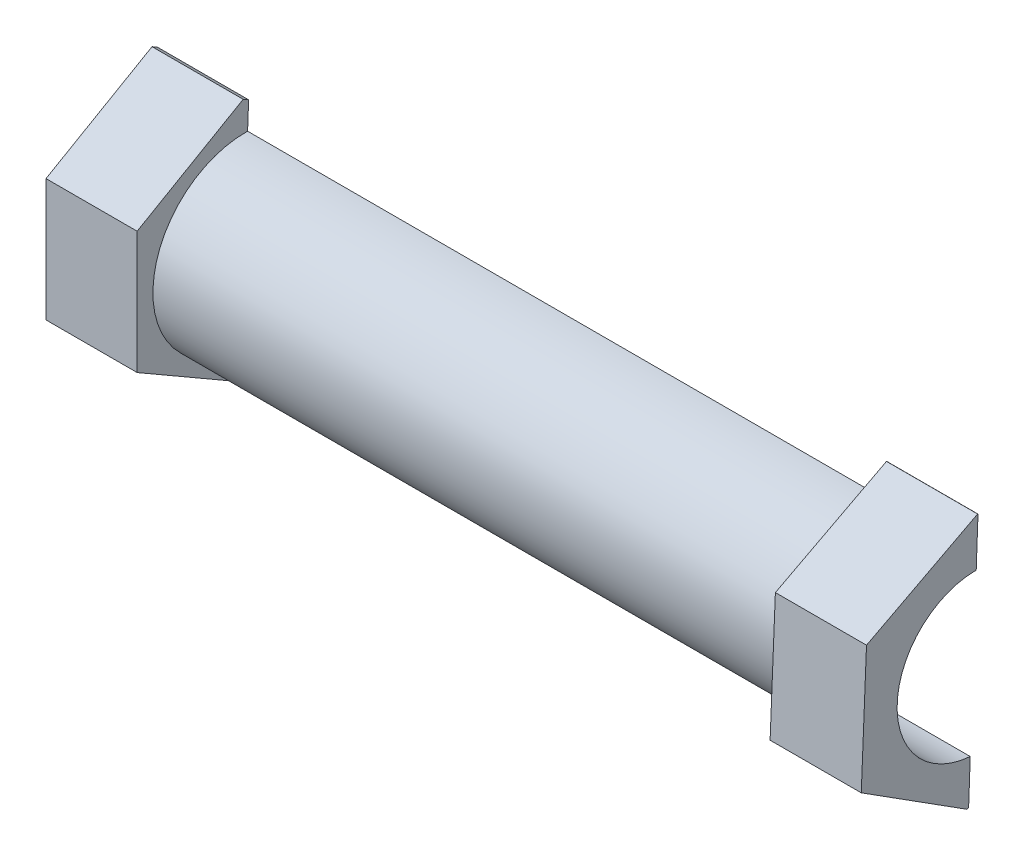
from build123d import *

# Parameters (mm, degrees)
SKETCH1_R            = 50.800375113
SKETCH1_R_2          = 47.812951641
BOSS_EXTRUDE2_DEPTH  = 350
BOSS_EXTRUDE5_DEPTH  = 50
BOSS_EXTRUDE11_DEPTH = 50
SKETCH6_R            = 44.996318031
CUT_EXTRUDE2_DEPTH   = 50
SKETCH7_R            = 43.517898498
CUT_EXTRUDE3_DEPTH   = 50
CUT_EXTRUDE5_DEPTH   = 460.276368741


with BuildPart() as part:
    # Sketch1 → Boss-Extrude2 (new body)
    with BuildSketch(Plane(origin=(0, 0, 0), x_dir=(0, 0, -1), z_dir=(1, 0, 0))):
        with Locations((1.289702318, 0)):
            Circle(SKETCH1_R)
        with Locations((1.289702318, 0)):
            Circle(SKETCH1_R_2, mode=Mode.SUBTRACT)
    extrude(amount=BOSS_EXTRUDE2_DEPTH)

    # Sketch3 → Boss-Extrude5 (add)
    with BuildSketch(Plane(origin=(350, 0, 0), x_dir=(0, 0, -1), z_dir=(1, 0, 0))):
        Polygon((58.055626726, -36.855405481), (60.945530776, 31.849944836), (2.88990405, 68.705350317), (-58.055626726, 36.855405481), (-60.945530776, -31.849944836), (-2.88990405, -68.705350317), align=None)
        Polygon((29.411876605, -18.99044871), (30.315925302, 11.383738416), (4.46313198, 27.353761118), (-22.293710039, 12.949596693), (-23.197758737, -17.424590433), (2.655034585, -33.394613135), align=None, mode=Mode.SUBTRACT)
    extrude(amount=BOSS_EXTRUDE5_DEPTH)

    # Sketch5 → Boss-Extrude11 (add)
    with BuildSketch(Plane.ZY):
        Polygon((0, -67.161353017), (58.163437865, -33.580676508), (58.163437865, 33.580676508), (0, 67.161353017), (-58.163437865, 33.580676508), (-58.163437865, -33.580676508), align=None)
    extrude(amount=BOSS_EXTRUDE11_DEPTH)

    # Sketch6 → Cut-Extrude2 (cut)
    with BuildSketch(Plane(origin=(0, 0, 0), x_dir=(0, 0, -1), z_dir=(1, 0, 0))):
        with Locations((2.167278034, 0)):
            Circle(SKETCH6_R)
    extrude(amount=-CUT_EXTRUDE2_DEPTH, mode=Mode.SUBTRACT)

    # Sketch7 → Cut-Extrude3 (cut)
    with BuildSketch(Plane.ZY.offset(-350)):
        with Locations((-2.231478452, -1.09442532)):
            Circle(SKETCH7_R)
    extrude(amount=-CUT_EXTRUDE3_DEPTH, mode=Mode.SUBTRACT)

    # Sketch9 → Cut-Extrude5 (cut, through all)
    with BuildSketch(Plane(origin=(400, 0, 0), x_dir=(0, 0, -1), z_dir=(1, 0, 0))):
        Polygon((3.435375401, 77.5085151), (88.372603531, 77.5085151), (88.372603531, -82.273926917), (-2.672776716, -84.939108123), align=None)
    extrude(amount=-CUT_EXTRUDE5_DEPTH, mode=Mode.SUBTRACT)


solid = part.part
